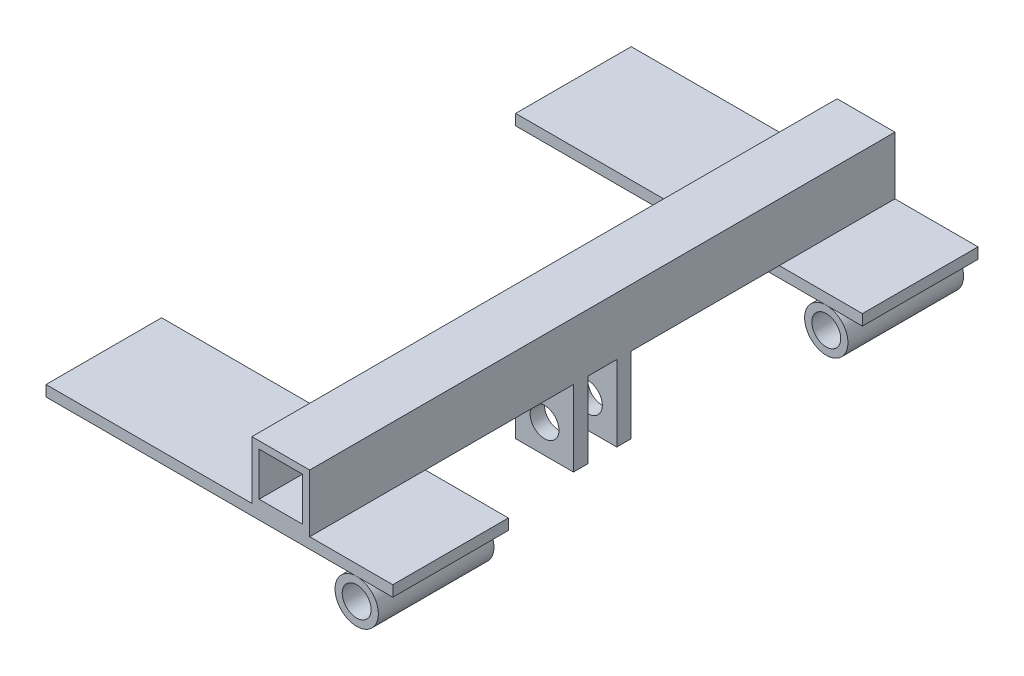
from build123d import *

# Parameters (mm, degrees)
SKETCH1_R               = 19.05
SKETCH1_R_2             = 12.7
EXTRUDE1_DEPTH          = 257.175
SKETCH2_W               = 304.8
SKETCH2_H               = 101.6
EXTRUDE2_DEPTH          = 9.525
EXTRUDE2_2_DEPTH        = 9.525
SKETCH3_W               = 50.8
SKETCH3_H               = 66.675
SKETCH3_R               = 12.7
EXTRUDE3_DEPTH          = 25.4
SKETCH4_W               = 50.8
SKETCH4_H               = 25.4
CUT_EXTRUDE1_DEPTH      = 66.675
CUT_EXTRUDE2_DEPTH      = 378.023730188
CUT_EXTRUDE2_DEPTH_BACK = 378.023730188
SKETCH5_W               = 38.1
SKETCH5_H               = 311.15
EXTRUDE4_START          = -257.175
SKETCH7_W               = 50.8
SKETCH7_H               = 50.8
SKETCH7_W_2             = 38.1
SKETCH7_H_2             = 38.1
EXTRUDE4_DEPTH          = 514.35


with BuildPart() as part:
    # Sketch1 → Extrude1 (new, symmetric)
    with BuildSketch(Plane.XY):
        Circle(SKETCH1_R)
        Circle(SKETCH1_R_2, mode=Mode.SUBTRACT)
    extrude(amount=EXTRUDE1_DEPTH, both=True)

    # Sketch5 → Cut-Extrude2 (cut, two sides: drawn at the far end of the back side and taken through both)
    with BuildSketch(Plane(origin=(0, 0, 0), x_dir=(1, 0, 0), z_dir=(0, 1, 0)).offset(-CUT_EXTRUDE2_DEPTH_BACK)):
        Rectangle(SKETCH5_W, SKETCH5_H)
    extrude(amount=CUT_EXTRUDE2_DEPTH + CUT_EXTRUDE2_DEPTH_BACK, mode=Mode.SUBTRACT)


with BuildPart() as body_2:
    # Sketch2 → Extrude2 (new body)
    with BuildSketch(Plane(origin=(0, 19.05, 0), x_dir=(-1, 0, 0), z_dir=(0, 1, 0))):
        with Locations((120.65, 206.375)):
            Rectangle(SKETCH2_W, SKETCH2_H)
    extrude(amount=EXTRUDE2_DEPTH)



with BuildPart() as body_3:
    # Sketch2 → Extrude2 2 (new body)
    with BuildSketch(Plane(origin=(0, 19.05, 0), x_dir=(-1, 0, 0), z_dir=(0, 1, 0))):
        with Locations((120.65, -206.375)):
            Rectangle(SKETCH2_W, SKETCH2_H)
    extrude(amount=EXTRUDE2_2_DEPTH)


with BuildPart() as body_4:
    # Sketch3 → Extrude3 (new, symmetric)
    with BuildSketch(Plane.XY):
        with Locations((-66.675, -4.7625)):
            Rectangle(SKETCH3_W, SKETCH3_H)
        with Locations((-66.675, -12.7)):
            Circle(SKETCH3_R, mode=Mode.SUBTRACT)
    extrude(amount=EXTRUDE3_DEPTH, both=True)

    # Sketch4 → Cut-Extrude1 (cut)
    with BuildSketch(Plane(origin=(0, 28.575, 0), x_dir=(-1, 0, 0), z_dir=(0, 1, 0))):
        with Locations((66.675, 0)):
            Rectangle(SKETCH4_W, SKETCH4_H)
    extrude(amount=-CUT_EXTRUDE1_DEPTH, mode=Mode.SUBTRACT)


with BuildPart() as cut_extrude1_piece_1:
    # of the separate pieces the step leaves, piece 1, a body of its own (cut_extrude1_pieces)
    add(body_4.part.solids().sort_by_distance((-92.075, 28.575, 25.4))[0])


with BuildPart() as cut_extrude1_piece_2:
    # of the separate pieces the step leaves, piece 2, a body of its own (cut_extrude1_pieces)
    add(body_4.part.solids().sort_by_distance((-92.075, 28.575, -12.7))[0])


with BuildPart() as cut_extrude2_piece_1:
    # of the separate pieces the step leaves, piece 1, a body of its own (cut_extrude2_pieces)
    add(part.part.solids().sort_by_distance((19.05, 0, 155.575))[0])


with BuildPart() as cut_extrude2_piece_2:
    # of the separate pieces the step leaves, piece 2, a body of its own (cut_extrude2_pieces)
    add(part.part.solids().sort_by_distance((19.05, 0, -257.175))[0])


with BuildPart() as body_2_1:
    add(body_2.part)

    add(body_3.part)  # Extrude4 merges body 3

    add(cut_extrude1_piece_1.part)  # Extrude4 merges Cut-Extrude1 piece 1

    add(cut_extrude1_piece_2.part)  # Extrude4 merges Cut-Extrude1 piece 2
    # Sketch7 → Extrude4 (add)
    with BuildSketch(Plane.XY.offset(EXTRUDE4_START)):
        with Locations((-66.675, 53.975)):
            Rectangle(SKETCH7_W, SKETCH7_H)
        with Locations((-66.675, 53.975)):
            Rectangle(SKETCH7_W_2, SKETCH7_H_2, mode=Mode.SUBTRACT)
    extrude(amount=EXTRUDE4_DEPTH)


solid = Compound([cut_extrude2_piece_1.part, cut_extrude2_piece_2.part, body_2_1.part])
